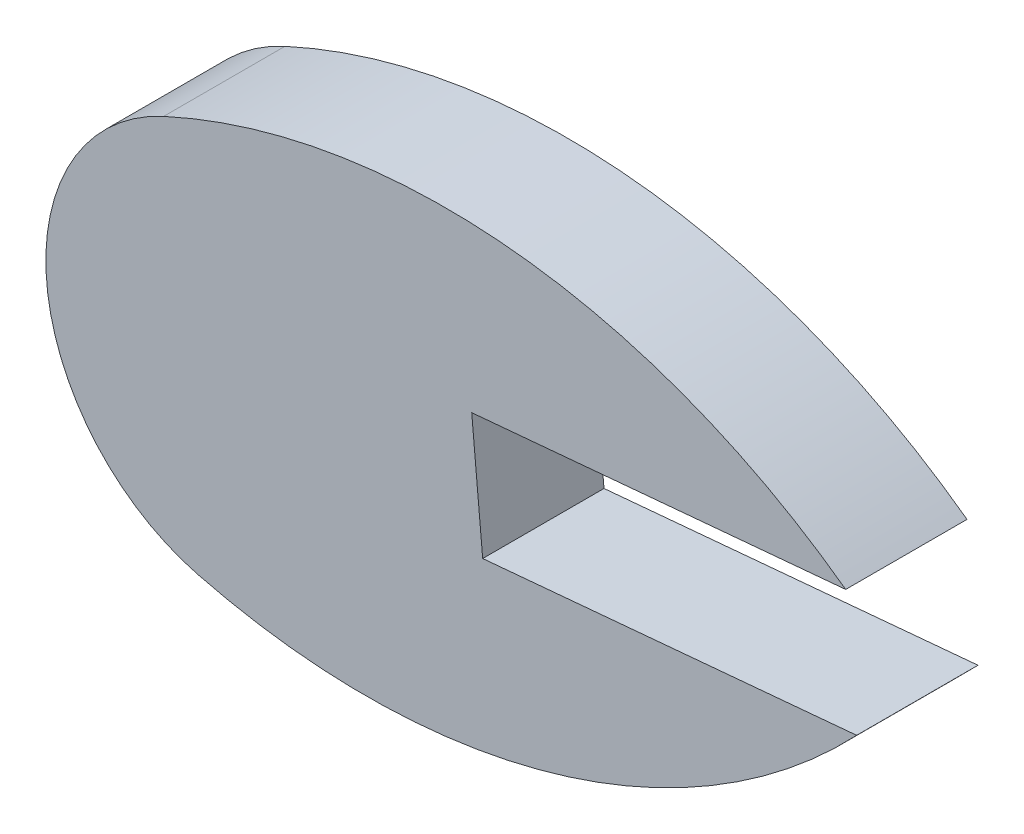
from build123d import *

# Parameters (mm, degrees)
BASE_EXTRUDE_DEPTH = 3


with BuildPart() as part:
    # Sketch1 → Base-Extrude (new body)
    with BuildSketch(Plane.XY):
        with BuildLine():
            Line((-856.474214644, -32.641915538), (-865.720770196, -33.480229749))
            Line((-865.720770196, -33.480229749), (-865.991646191, -30.492483743))
            Line((-865.991646191, -30.492483743), (-856.745090639, -29.654169532))
            ThreePointArc((-856.745090639, -29.654169532), (-864.946405641, -26.511655783), (-873.609416526, -27.957063286))
            ThreePointArc((-873.609416526, -27.957063286), (-876.500341632, -32.951378616), (-872.758344407, -37.344337795))
            ThreePointArc((-872.758344407, -37.344337795), (-863.976635131, -37.208166435), (-856.474214644, -32.641915538))
        make_face()
    extrude(amount=BASE_EXTRUDE_DEPTH)


solid = part.part
